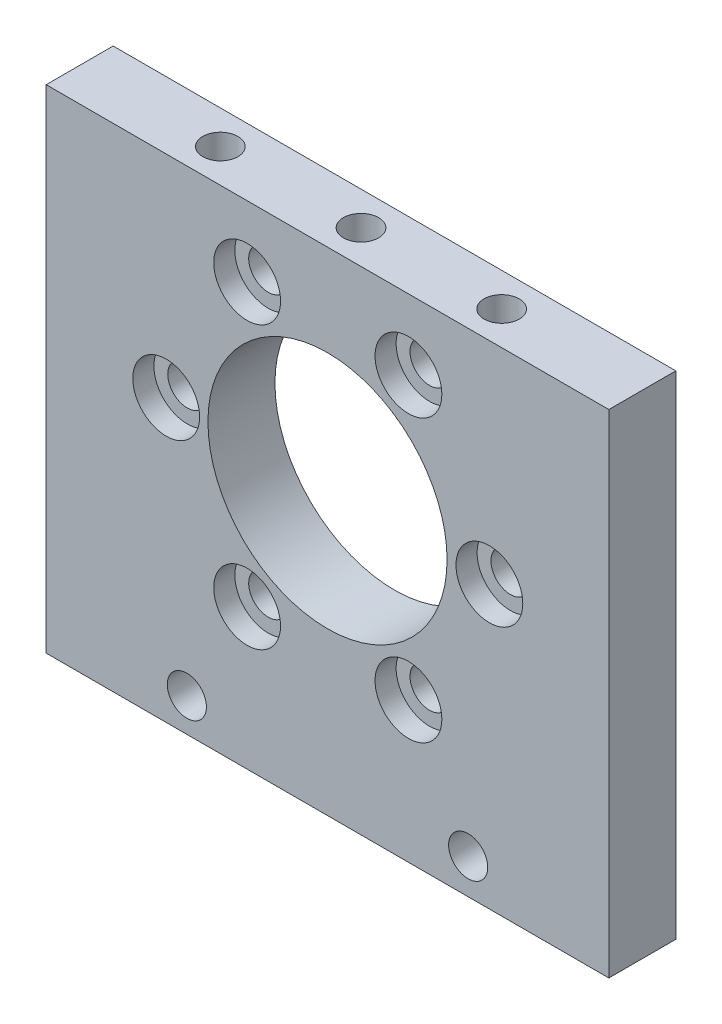
from build123d import *

# Parameters (mm, degrees)
RESSALTO_EXTRUS_O1_DEPTH = 9.525
ESBO_O3_R                = 2.5
CORTE_EXTRUS_O1_DEPTH    = 23
ESBO_O11_R               = 2.78
CORTE_EXTRUS_O4_DEPTH    = 9.525
ESBO_O13_R               = 17
CORTE_EXTRUS_O5_DEPTH    = 10
ESBO_O14_R               = 2.78
CORTE_EXTRUS_O6_DEPTH    = 9.525
ESBO_O16_R               = 4.75
CORTE_EXTRUS_O9_DEPTH    = 3


with BuildPart() as part:
    # Esboço2 → Ressalto-extrusão1 (new body)
    with BuildSketch(Plane.XY):
        Polygon((-40, 35), (-40, 0), (-40, -35), (40, -35), (40, 0), (40, 35), align=None)
    extrude(amount=RESSALTO_EXTRUS_O1_DEPTH)

    # Esboço3 → Corte-extrusão1 (cut)
    with BuildSketch(Plane(origin=(0, 35, 0), x_dir=(-1, 0, 0), z_dir=(0, 1, 0))):
        with Locations((20, 4.7625)):
            Circle(ESBO_O3_R)
        with Locations((0, 4.7625)):
            Circle(ESBO_O3_R)
        with Locations((-20, 4.7625)):
            Circle(ESBO_O3_R)
    extrude(amount=-CORTE_EXTRUS_O1_DEPTH, mode=Mode.SUBTRACT)

    # Esboço11 → Corte-extrusão4 (cut)
    with BuildSketch(Plane.XY.offset(9.525)):
        with Locations((-20, -30.2375)):
            Circle(ESBO_O11_R)
        with Locations((20, -30)):
            Circle(ESBO_O11_R)
    extrude(amount=-CORTE_EXTRUS_O4_DEPTH, mode=Mode.SUBTRACT)

    # Esboço13 → Corte-extrusão5 (cut)
    with BuildSketch(Plane(origin=(0, 0, 0), x_dir=(-1, 0, 0), z_dir=(0, 0, -1))):
        with Locations((0, 5)):
            Circle(ESBO_O13_R)
    extrude(amount=-CORTE_EXTRUS_O5_DEPTH, mode=Mode.SUBTRACT)

    # Esboço14 → Corte-extrusão6 (cut)
    with BuildSketch(Plane(origin=(0, 0, 0), x_dir=(-1, 0, 0), z_dir=(0, 0, -1))):
        with Locations((-23.015, 5)):
            Circle(ESBO_O14_R)
        with Locations((-11.5075, -15)):
            Circle(ESBO_O14_R)
        with Locations((-11.5075, 25)):
            Circle(ESBO_O14_R)
        with Locations((11.428624391, 25)):
            Circle(ESBO_O14_R)
        with Locations((22.936124391, 5)):
            Circle(ESBO_O14_R)
        with Locations((11.428624391, -15)):
            Circle(ESBO_O14_R)
    extrude(amount=-CORTE_EXTRUS_O6_DEPTH, mode=Mode.SUBTRACT)

    # Esboço16 → Corte-extrusão9 (cut)
    with BuildSketch(Plane.XY.offset(9.525)):
        with Locations((-22.936124391, 5)):
            Circle(ESBO_O16_R)
        with Locations((-11.428624391, 25)):
            Circle(ESBO_O16_R)
        with Locations((11.5075, 25)):
            Circle(ESBO_O16_R)
        with Locations((23.015, 5)):
            Circle(ESBO_O16_R)
        with Locations((11.5075, -15)):
            Circle(ESBO_O16_R)
        with Locations((-11.428624391, -15)):
            Circle(ESBO_O16_R)
    extrude(amount=-CORTE_EXTRUS_O9_DEPTH, mode=Mode.SUBTRACT)


solid = part.part
